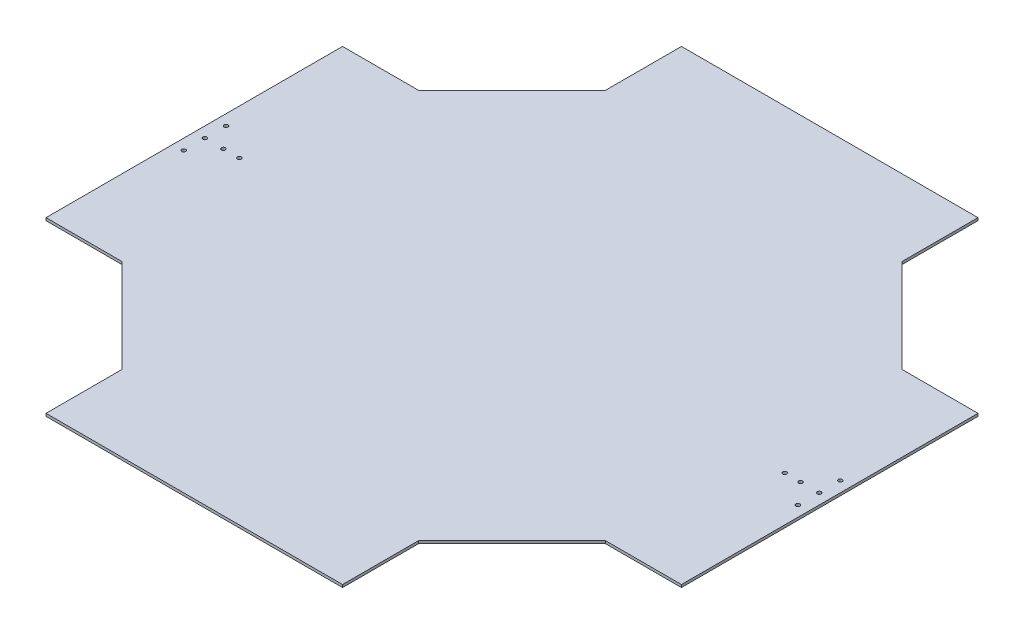
from build123d import *

# Parameters (mm, degrees)
BOSS_EXTRUDE1_DEPTH = 1.5875
SKETCH2_R           = 2.38125
CUT_EXTRUDE1_DEPTH  = 539.824721616


with BuildPart() as part:
    # Sketch1 → Boss-Extrude1 (new, symmetric)
    with BuildSketch(Plane(origin=(0, 0, 0), x_dir=(1, 0, 0), z_dir=(0, 1, 0))):
        Polygon((-381, 177.8), (-289.71875, 177.8), (-177.8, 289.71875), (-177.8, 381), (177.8, 381), (177.8, 289.71875), (289.71875, 177.8), (381, 177.8), (381, -177.8), (289.71875, -177.8), (177.8, -289.71875), (177.8, -381), (-177.8, -381), (-177.8, -289.71875), (-289.71875, -177.8), (-381, -177.8), align=None)
    extrude(amount=BOSS_EXTRUDE1_DEPTH, both=True)

    # Sketch2 → Cut-Extrude1 (cut, through all)
    with BuildSketch(Plane(origin=(0, 1.5875, 0), x_dir=(1, 0, 0), z_dir=(0, 1, 0))):
        with Locations(Location((-346.075, 0, 0), (0, 0, 270))):
            Circle(SKETCH2_R)
        with Locations(Location((-368.3, 0, 0), (0, 0, 270))):
            Circle(SKETCH2_R)
        with Locations(Location((-368.3, 25.4, 0), (0, 0, 270))):
            Circle(SKETCH2_R)
        with Locations(Location((-368.3, -25.4, 0), (0, 0, 270))):
            Circle(SKETCH2_R)
        with Locations(Location((368.3, -25.4, 0), (0, 0, 90))):
            Circle(SKETCH2_R)
        with Locations(Location((368.3, 25.4, 0), (0, 0, 90))):
            Circle(SKETCH2_R)
        with Locations(Location((368.3, 0, 0), (0, 0, 90))):
            Circle(SKETCH2_R)
        with Locations(Location((346.075, 0, 0), (0, 0, 90))):
            Circle(SKETCH2_R)
        with Locations(Location((-327.025, 0, 0), (0, 0, 270))):
            Circle(SKETCH2_R)
        with Locations(Location((327.025, 0, 0), (0, 0, 270))):
            Circle(SKETCH2_R)
    extrude(amount=-CUT_EXTRUDE1_DEPTH, mode=Mode.SUBTRACT)


solid = part.part
